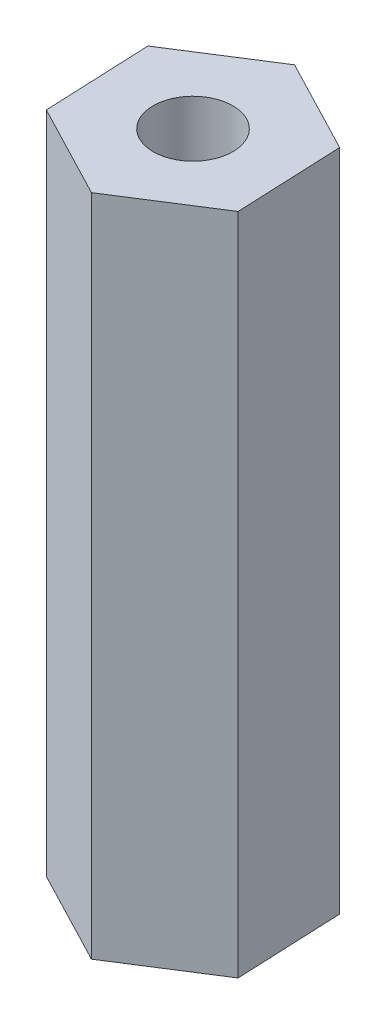
from build123d import *

# Parameters (mm, degrees)
BOSS_EXTRUDE2_DEPTH = 25
SKETCH3_R           = 1.5
CUT_EXTRUDE1_DEPTH  = 25


with BuildPart() as part:
    # Sketch1 → Boss-Extrude2 (new body)
    with BuildSketch(Plane(origin=(0, 0, 0), x_dir=(1, 0, 0), z_dir=(0, 1, 0))):
        Polygon((-3.547011973, 1.848974327), (-3.374764724, -2.147315313), (0.172247249, -3.99628964), (3.547011973, -1.848974327), (3.374764724, 2.147315313), (-0.172247249, 3.99628964), align=None)
    extrude(amount=BOSS_EXTRUDE2_DEPTH)

    # Sketch3 → Cut-Extrude1 (cut)
    with BuildSketch(Plane(origin=(0, 25, 0), x_dir=(1, 0, 0), z_dir=(0, 1, 0))):
        with Locations(Location((0, 0, 0), (0, 0, 270))):
            Circle(SKETCH3_R)
    extrude(amount=-CUT_EXTRUDE1_DEPTH, mode=Mode.SUBTRACT)


solid = part.part
